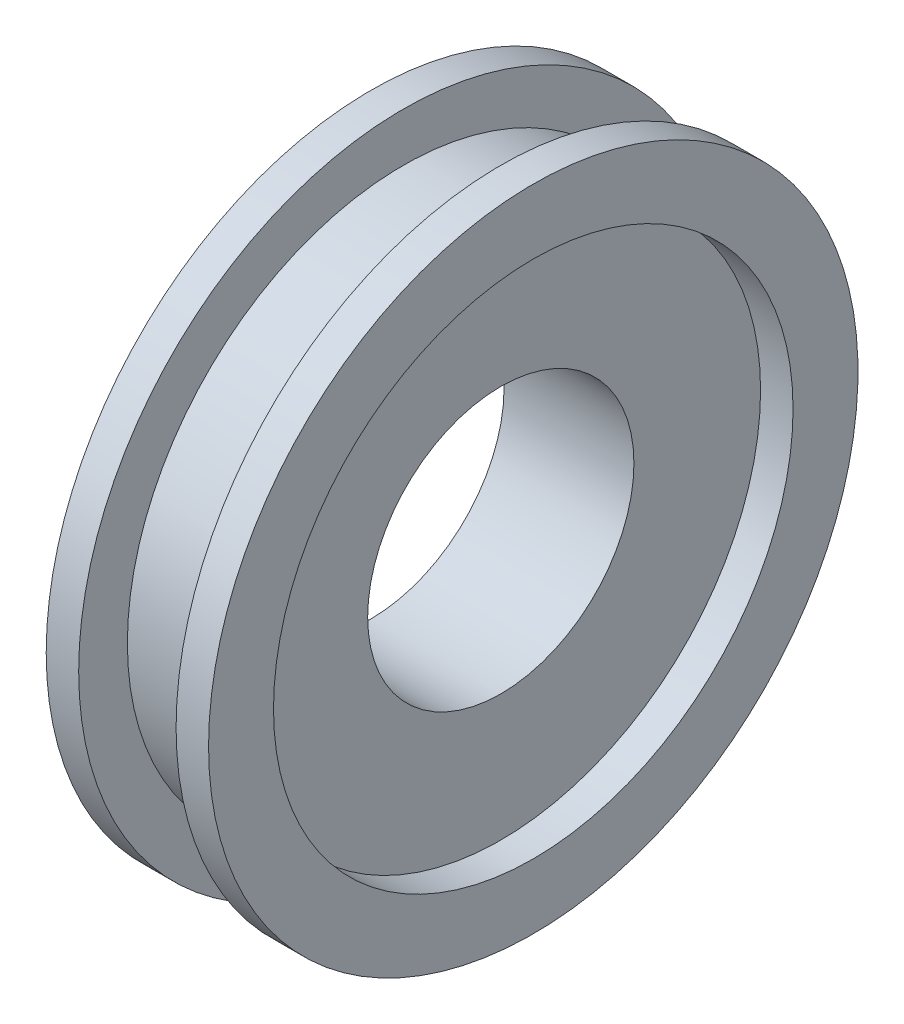
from build123d import *

# Parameters (mm, degrees)
SKETCH1_W          = 5
SKETCH1_H          = 5.9
SKETCH2_W          = 3
SKETCH2_H          = 1.5
SKETCH3_R          = 8
CUT_EXTRUDE1_DEPTH = 1.5
CUT_EXTRUDE2_DEPTH = 1.5


with BuildPart() as part:
    # Sketch1 → Revolve1 (revolve)
    with BuildSketch(Plane.XY, mode=Mode.PRIVATE) as revolve1_sk:
        with Locations((-3, 7.05)):
            Rectangle(SKETCH1_W, SKETCH1_H)
    revolve(revolve1_sk.sketch.rotate(Axis((0, 0, 0), (1, 0, 0)), 90), axis=Axis((0, 0, 0), (1, 0, 0)))

    # Sketch2 → Cut-Revolve1 (revolve, cut)
    with BuildSketch(Plane.XY, mode=Mode.PRIVATE) as cut_revolve1_sk:
        with Locations((-3, 9.25)):
            Rectangle(SKETCH2_W, SKETCH2_H)
    revolve(cut_revolve1_sk.sketch.rotate(Axis((0, 0, 0), (1, 0, 0)), 90), axis=Axis((0, 0, 0), (1, 0, 0)), mode=Mode.SUBTRACT)

    # Sketch3 → Cut-Extrude1 (cut)
    with BuildSketch(Plane(origin=(0, 0, 0), x_dir=(0, 0, -1), z_dir=(1, 0, 0))):
        Circle(SKETCH3_R)
    extrude(amount=-CUT_EXTRUDE1_DEPTH, mode=Mode.SUBTRACT)

    # Sketch5 → Cut-Extrude2 (cut)
    # profile 1 of 2: a face of its own
    with BuildSketch(Plane.ZY.offset(5.5)):
        Polygon((-1.793384415, 8.175), (-0.9125, 8.175), (-0.9125, 5), (-1.482371795, 5), (-1.482371795, 7.645833333), (-2.133653846, 7.645833333), align=None)
    # profile 2 of 2: a face of its own
    with BuildSketch(Plane.ZY.offset(5.5)):
        with BuildLine():
            Line((1.191446314, 8.256410256), (1.695808293, 8.00073117))
            Line((1.695808293, 8.00073117), (1.142472957, 6.913141026))
            add(Edge.make_bspline(
                [(1.142472957, 6.913141026), (1.175163489, 6.912294651), (1.239552854, 6.910627578), (1.334288739, 6.897154014), (1.424858008, 6.873861453), (1.512173869, 6.842987227), (1.595168965, 6.801522834), (1.675179981, 6.752198775), (1.750136991, 6.69204278), (1.821758695, 6.62539313), (1.886883941, 6.551554895), (1.943456732, 6.472213367), (1.99275892, 6.389298934), (2.031084458, 6.300956598), (2.061999112, 6.208650736), (2.084305396, 6.11201236), (2.097031755, 6.010761626), (2.098786295, 5.941977417), (2.099679487, 5.906961138)],
                knots=[0, 0, 0, 0, 1.013260694, 1.995783107, 2.958651975, 3.908806537, 4.861209129, 5.829647963, 6.817170299, 7.835534541, 8.860094905, 9.863329007, 10.853101798, 11.844815043, 12.84250023, 13.867713965, 14.914507806, 16, 16, 16, 16], degree=3))
            add(Edge.make_bspline(
                [(2.099679487, 5.906961138), (2.098842493, 5.873207569), (2.097188113, 5.806491238), (2.083512477, 5.708501914), (2.06141193, 5.614486889), (2.02982581, 5.524633922), (1.989677297, 5.438503809), (1.940578386, 5.356147091), (1.882121896, 5.278179194), (1.81581818, 5.205014401), (1.743336781, 5.138324152), (1.666937439, 5.079045977), (1.585972755, 5.030079955), (1.501973056, 4.988727002), (1.413391857, 4.957868741), (1.32155478, 4.934576099), (1.225765397, 4.921135234), (1.160746018, 4.91944503), (1.127844551, 4.918589744)],
                knots=[0, 0, 0, 0, 1.049934834, 2.075270938, 3.072134561, 4.05064612, 5.033440221, 6.024524368, 7.028587226, 8.060776465, 9.092543989, 10.090062252, 11.064205434, 12.031961459, 12.998029633, 13.977230324, 14.976426867, 16, 16, 16, 16], degree=3))
            add(Edge.make_bspline(
                [(1.127844551, 4.918589744), (1.093439615, 4.919291632), (1.025786964, 4.9206718), (0.926794204, 4.936126046), (0.831851626, 4.959390259), (0.741492825, 4.992607602), (0.655155886, 5.034903587), (0.57385727, 5.087240616), (0.496912148, 5.149041549), (0.42514087, 5.218915965), (0.360480297, 5.295453826), (0.302808469, 5.374920054), (0.254018029, 5.457439347), (0.214523305, 5.542923478), (0.183708605, 5.631100047), (0.162267859, 5.722136406), (0.148297235, 5.81579108), (0.146659497, 5.879350442), (0.145833333, 5.911413261)],
                knots=[0, 0, 0, 0, 1.063775006, 2.091769615, 3.092589432, 4.084662827, 5.064601646, 6.061867366, 7.070035304, 8.113879863, 9.156342271, 10.166834137, 11.149076039, 12.117706134, 13.076241869, 14.034148791, 15.008317125, 16, 16, 16, 16], degree=3))
            add(Edge.make_bspline(
                [(0.145833333, 5.911413261), (0.146269862, 5.936242164), (0.14714535, 5.986038176), (0.155943478, 6.060604999), (0.169319723, 6.135367552), (0.184824543, 6.198454562), (0.20078984, 6.251801232), (0.216859033, 6.296947076), (0.236773258, 6.347049092), (0.259538168, 6.40223522), (0.285869634, 6.462439071), (0.315630108, 6.527496544), (0.348893678, 6.597900304), (0.372615185, 6.646256786), (0.384975962, 6.671454327)],
                knots=[0, 0, 0, 0, 1.110454016, 2.227089276, 3.35462975, 4.507227546, 5.131400587, 5.845402449, 6.650387134, 7.543487832, 8.516250726, 9.590168902, 10.744287919, 12, 12, 12, 12], degree=3))
            Line((0.384975962, 6.671454327), (1.191446314, 8.256410256))
        make_face()
        with BuildLine():
            add(Edge.make_bspline(
                [(1.115124199, 6.383974359), (1.087780016, 6.382720139), (1.034271038, 6.380265795), (0.958189275, 6.354562713), (0.888819969, 6.314240974), (0.828689797, 6.258085155), (0.77839644, 6.190976745), (0.741439117, 6.114430641), (0.719207234, 6.029468327), (0.716897483, 5.970064094), (0.715705128, 5.939398037)],
                knots=[0, 0, 0, 0, 0.981744412, 1.921144944, 2.858899012, 3.85339082, 4.86292663, 5.863643845, 6.897155691, 8, 8, 8, 8], degree=3))
            add(Edge.make_bspline(
                [(0.715705128, 5.939398037), (0.717116914, 5.908721768), (0.719862931, 5.849054373), (0.742930763, 5.763283067), (0.780699961, 5.684998689), (0.833668853, 5.617000948), (0.895853571, 5.560557558), (0.964809047, 5.518814972), (1.039385079, 5.493171132), (1.090971142, 5.490042243), (1.117032252, 5.488461538)],
                knots=[0, 0, 0, 0, 1.098279937, 2.136227893, 3.159405121, 4.194678092, 5.206500211, 6.154139736, 7.067477469, 8, 8, 8, 8], degree=3))
            add(Edge.make_bspline(
                [(1.117032252, 5.488461538), (1.144555729, 5.490070396), (1.198534047, 5.493225646), (1.276401312, 5.51779044), (1.347533526, 5.558833701), (1.410428162, 5.615096382), (1.464453459, 5.682318178), (1.501833508, 5.761062388), (1.525967776, 5.847452761), (1.528499022, 5.908062449), (1.529807692, 5.939398037)],
                knots=[0, 0, 0, 0, 0.96921794, 1.900804717, 2.848419905, 3.844199796, 4.861108892, 5.867439427, 6.897452859, 8, 8, 8, 8], degree=3))
            add(Edge.make_bspline(
                [(1.529807692, 5.939398037), (1.528316878, 5.970046189), (1.525429742, 6.029399913), (1.503743929, 6.114760256), (1.465025374, 6.191011323), (1.41359409, 6.258362168), (1.351394556, 6.314492947), (1.279248949, 6.354880703), (1.199691644, 6.380220258), (1.143724347, 6.382704747), (1.115124199, 6.383974359)],
                knots=[0, 0, 0, 0, 1.083229974, 2.097801324, 3.086792542, 4.086858909, 5.079819718, 6.026392613, 6.991456328, 8, 8, 8, 8], degree=3))
        make_face(mode=Mode.SUBTRACT)
    extrude(amount=-CUT_EXTRUDE2_DEPTH, mode=Mode.SUBTRACT)


solid = part.part
